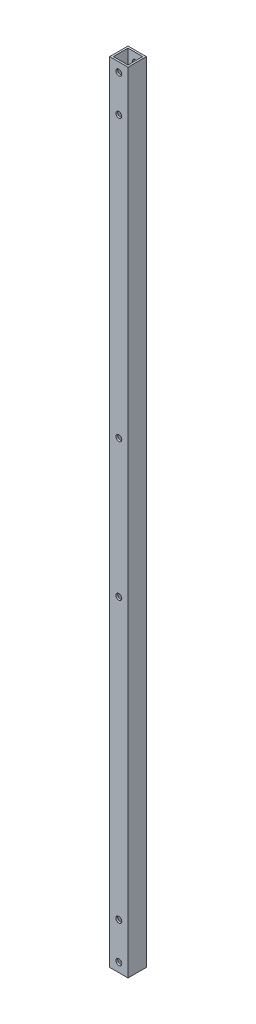
from build123d import *

# Parameters (mm, degrees)
SKETCH_1_W          = 10
SKETCH_1_H          = 10
SKETCH_1_W_2        = 8
SKETCH_1_H_2        = 8
EXTRUDE_1_DEPTH     = 214.97
SKETCH_2_R          = 1.6
CUT_EXTRUDE_1_DEPTH = 213.715
SKETCH_3_R          = 1.6
CUT_EXTRUDE_2_DEPTH = 10


with BuildPart() as part:
    # ｽｹｯﾁ1 → ﾎﾞｽ - 押し出し1 (new, symmetric)
    with BuildSketch(Plane(origin=(0, 0, 0), x_dir=(1, 0, 0), z_dir=(0, 1, 0))):
        Rectangle(SKETCH_1_W, SKETCH_1_H)
        Rectangle(SKETCH_1_W_2, SKETCH_1_H_2, mode=Mode.SUBTRACT)
    extrude(amount=EXTRUDE_1_DEPTH, both=True)

    # ｽｹｯﾁ2 → ｶｯﾄ - 押し出し1 (cut, symmetric)
    with BuildSketch(Plane.XY.offset(5)):
        with Locations((0, 209.97)):
            Circle(SKETCH_2_R)
        with Locations((0, 189.97)):
            Circle(SKETCH_2_R)
    cut_extrude_1 = extrude(amount=CUT_EXTRUDE_1_DEPTH, both=True, mode=Mode.SUBTRACT)

    # ﾐﾗｰ1: ｶｯﾄ - 押し出し1 across plane
    add(cut_extrude_1.mirror(Plane.ZX), mode=Mode.SUBTRACT)

    # ｽｹｯﾁ3 → ｶｯﾄ - 押し出し2 (cut)
    with BuildSketch(Plane(origin=(0, 0, -5), x_dir=(-1, 0, 0), z_dir=(0, 0, -1))):
        with Locations((0, -37.579717656)):
            Circle(SKETCH_3_R)
        with Locations((-0.004999398, 37.420282344)):
            Circle(SKETCH_3_R)
    extrude(amount=-CUT_EXTRUDE_2_DEPTH, mode=Mode.SUBTRACT)


solid = part.part
